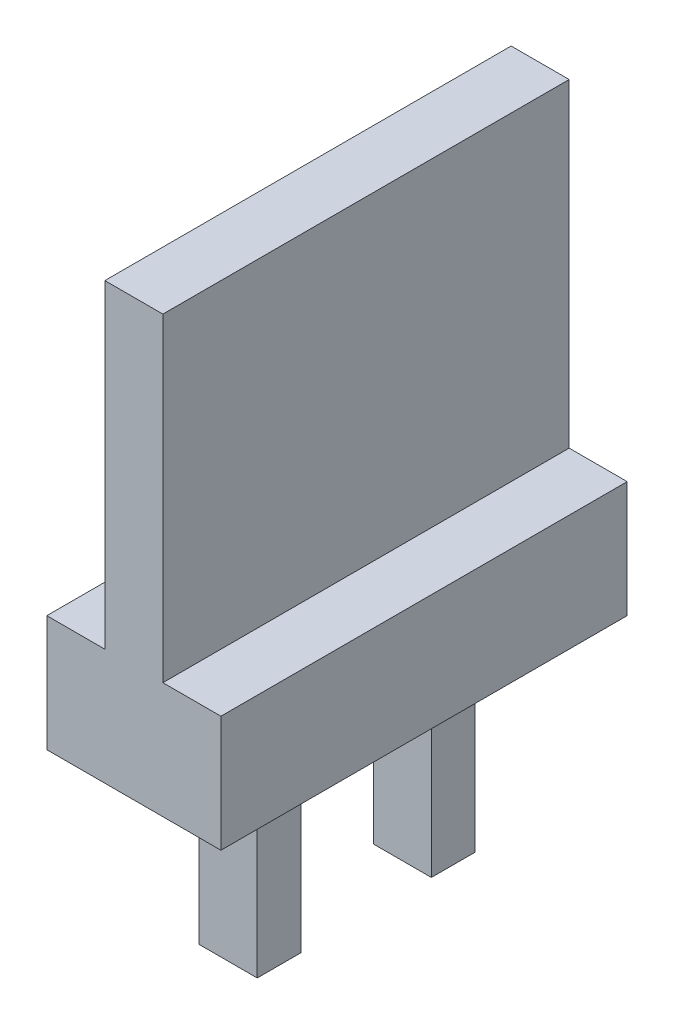
from build123d import *

# Parameters (mm, degrees)
BOSS_EXTRUDE1_DEPTH = 28
SKETCH2_W           = 8
SKETCH2_H           = 15
BOSS_EXTRUDE2_DEPTH = 2
SKETCH3_W           = 4
SKETCH3_H           = 10.874014098
BOSS_EXTRUDE3_DEPTH = 3
SKETCH5_W           = 4
SKETCH5_H           = 10.874014098
BOSS_EXTRUDE4_DEPTH = 3


with BuildPart() as part:
    # Sketch1 → Boss-Extrude1 (new body)
    with BuildSketch(Plane.XY):
        Polygon((-2.208632101, 1.734693878), (-2.208632101, 23.734693878), (1.791367899, 23.734693878), (1.791367899, 1.734693878), (5.791367899, 1.734693878), (5.791367899, -6.265306122), (-6.208632101, -6.265306122), (-6.208632101, 1.734693878), align=None)
    extrude(amount=BOSS_EXTRUDE1_DEPTH)

    # Sketch2 → Boss-Extrude2 (add)
    with BuildSketch(Plane.XZ.offset(6.265306122)):
        with Locations((-0.208632101, 14)):
            Rectangle(SKETCH2_W, SKETCH2_H)
    extrude(amount=BOSS_EXTRUDE2_DEPTH)

    # Sketch3 → Boss-Extrude3 (add)
    with BuildSketch(Plane.XY.offset(21.5)):
        with Locations((-0.20614541, -13.702313171)):
            Rectangle(SKETCH3_W, SKETCH3_H)
    extrude(amount=-BOSS_EXTRUDE3_DEPTH)


with BuildPart() as body_2:
    # Sketch5 → Boss-Extrude4 (new body)
    with BuildSketch(Plane(origin=(0, 0, 6.5), x_dir=(-1, 0, 0), z_dir=(0, 0, -1))):
        with Locations((0.20614541, -13.702313171)):
            Rectangle(SKETCH5_W, SKETCH5_H)
    extrude(amount=-BOSS_EXTRUDE4_DEPTH)


solid = Compound([part.part, body_2.part])
